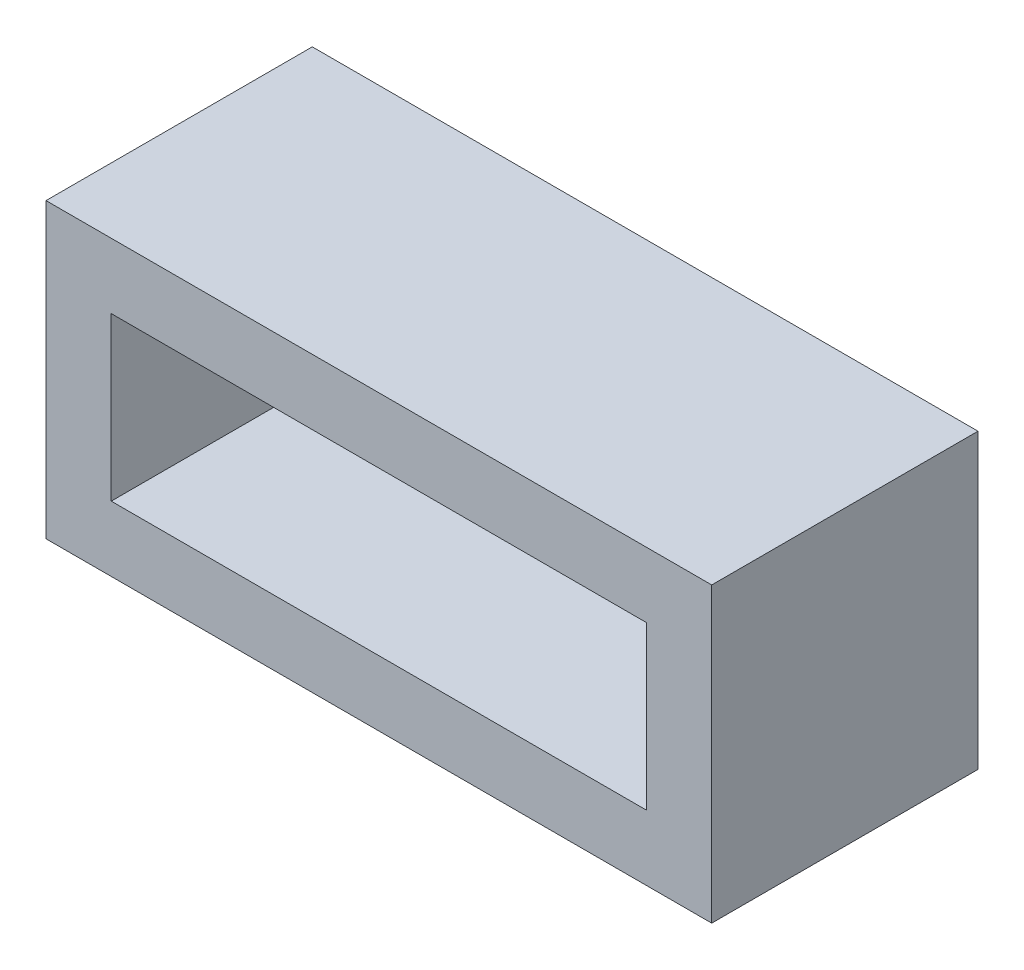
from build123d import *

# Parameters (mm, degrees)
SKETCH1_W           = 25
SKETCH1_H           = 11
SKETCH1_W_2         = 20.1
SKETCH1_H_2         = 6.1
BOSS_EXTRUDE1_DEPTH = 10


with BuildPart() as part:
    # Sketch1 → Boss-Extrude1 (new body)
    with BuildSketch(Plane.XY):
        Rectangle(SKETCH1_W, SKETCH1_H)
        Rectangle(SKETCH1_W_2, SKETCH1_H_2, mode=Mode.SUBTRACT)
    extrude(amount=BOSS_EXTRUDE1_DEPTH)


solid = part.part
